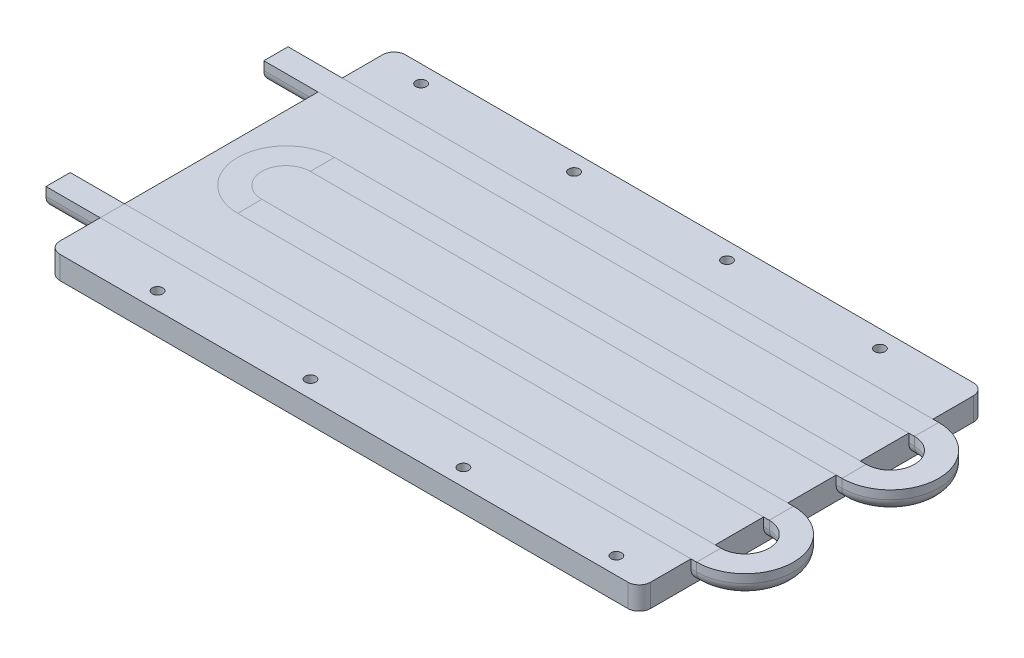
from build123d import *

# Parameters (mm, degrees)
SKETCH1_W           = 310
SKETCH1_H           = 181.3
SKETCH1_R           = 2.75
BOSS_EXTRUDE1_DEPTH = 12
FILLET1_R           = 6


with BuildPart() as part:
    # Sketch1 → Boss-Extrude1 (new body)
    with BuildSketch(Plane(origin=(0, 0, 0), x_dir=(1, 0, 0), z_dir=(0, 1, 0))):
        Rectangle(SKETCH1_W, SKETCH1_H)
        with Locations((-131.75, 81.65)):
            Circle(SKETCH1_R, mode=Mode.SUBTRACT)
        with Locations((-51.5, 81.65)):
            Circle(SKETCH1_R, mode=Mode.SUBTRACT)
        with Locations((28.75, 81.65)):
            Circle(SKETCH1_R, mode=Mode.SUBTRACT)
        with Locations((109, 81.65)):
            Circle(SKETCH1_R, mode=Mode.SUBTRACT)
        with Locations((-106.75, -81.65)):
            Circle(SKETCH1_R, mode=Mode.SUBTRACT)
        with Locations((-26.5, -81.65)):
            Circle(SKETCH1_R, mode=Mode.SUBTRACT)
        with Locations((53.75, -81.65)):
            Circle(SKETCH1_R, mode=Mode.SUBTRACT)
        with Locations((134, -81.65)):
            Circle(SKETCH1_R, mode=Mode.SUBTRACT)
    extrude(amount=BOSS_EXTRUDE1_DEPTH)

    # Fillet1
    fillet1_edges = [part.edges().sort_by_distance(p)[0] for p in [
        (155, 6, 90.65),
        (155, 6, -90.65),
        (-155, 6, -90.65),
        (-155, 6, 90.65),
    ]]
    fillet(fillet1_edges, radius=FILLET1_R)

    # Cut-Sweep1: sweep along a path in Sketch2
    with BuildLine(Plane(origin=(0, 12, 0), x_dir=(1, 0, 0), z_dir=(0, 1, 0))) as cut_sweep1_path:
        Line((-183.430806184, 57.15), (-155, 57.15))
        Line((-155, 57.15), (158, 57.15))
        ThreePointArc((158, 57.15), (177.05, 38.1), (158, 19.05))
        Line((158, 19.05), (-120.95, 19.05))
        ThreePointArc((-120.95, 19.05), (-140, 0), (-120.95, -19.05))
        Line((-120.95, -19.05), (158, -19.05))
        ThreePointArc((158, -19.05), (177.05, -38.1), (158, -57.15))
        Line((158, -57.15), (-155, -57.15))
        Line((-155, -57.15), (-183.430806184, -57.15))
    # Sketch3 → Cut-Sweep1 (sweep, cut)
    with BuildSketch(Plane.ZY.offset(155)):
        with BuildLine():
            Line((-63.5, 7.5), (-63.5, 12))
            Line((-63.5, 12), (-50.8, 12))
            Line((-50.8, 12), (-50.8, 7.5))
            ThreePointArc((-50.8, 7.5), (-57.15, 1.15), (-63.5, 7.5))
        make_face()
    sweep(path=cut_sweep1_path.line, mode=Mode.SUBTRACT)


with BuildPart() as body_2:
    # Sweep1: sweep along a path in Sketch2<2>
    with BuildLine(Plane(origin=(0, 12, 0), x_dir=(1, 0, 0), z_dir=(0, 1, 0))) as sweep1_path:
        Line((-183.430806184, 57.15), (-155, 57.15))
        Line((-155, 57.15), (158, 57.15))
        ThreePointArc((158, 57.15), (177.05, 38.1), (158, 19.05))
        Line((158, 19.05), (-120.95, 19.05))
        ThreePointArc((-120.95, 19.05), (-140, 0), (-120.95, -19.05))
        Line((-120.95, -19.05), (158, -19.05))
        ThreePointArc((158, -19.05), (177.05, -38.1), (158, -57.15))
        Line((158, -57.15), (-155, -57.15))
        Line((-155, -57.15), (-183.430806184, -57.15))
    # Sketch4 → Sweep1 (sweep)
    with BuildSketch(Plane.ZY.offset(155)):
        with BuildLine():
            Line((-63.5, 7.5), (-63.5, 12))
            Line((-63.5, 12), (-50.8, 12))
            Line((-50.8, 12), (-50.8, 7.5))
            ThreePointArc((-50.8, 7.5), (-57.15, 1.15), (-63.5, 7.5))
        make_face()
        with BuildLine():
            Line((-62.738, 7.5), (-62.738, 11.238))
            Line((-62.738, 11.238), (-51.562, 11.238))
            Line((-51.562, 11.238), (-51.562, 7.5))
            ThreePointArc((-51.562, 7.5), (-57.15, 1.912), (-62.738, 7.5))
        make_face(mode=Mode.SUBTRACT)
    sweep(path=sweep1_path.line)


solid = Compound([part.part, body_2.part])
